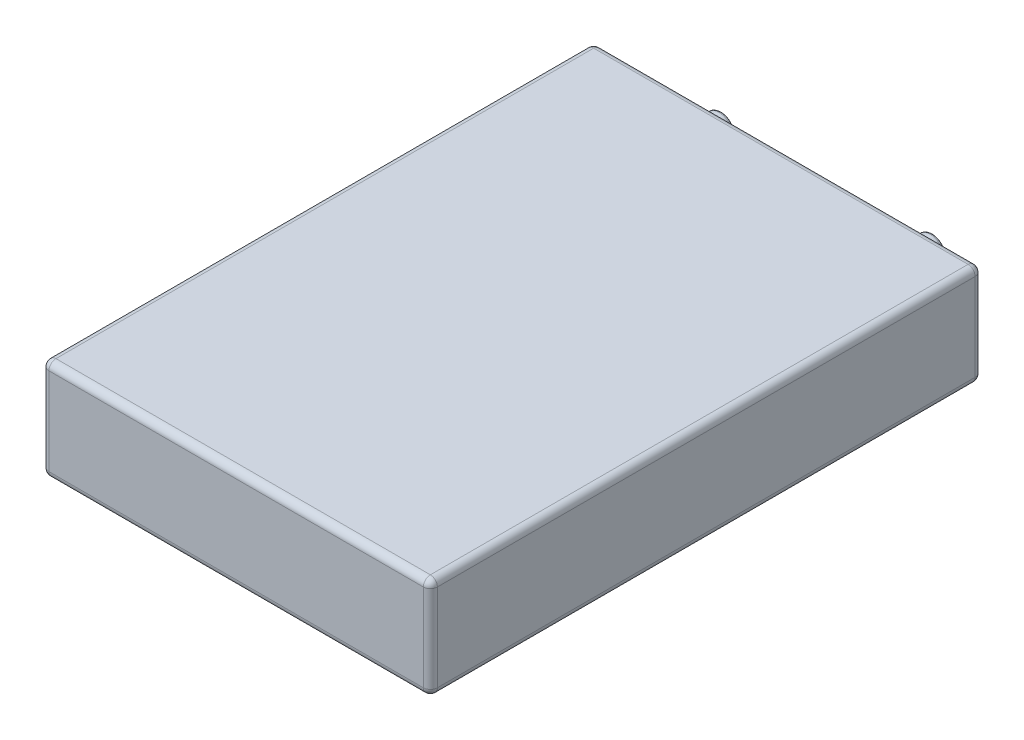
from build123d import *

# Parameters (mm, degrees)
BOSS_EXTRUDE1_DEPTH = 36
FILLET1_R           = 2.5
SKETCH2_R           = 10
BOSS_EXTRUDE2_DEPTH = 4
SKETCH3_R           = 5
BOSS_EXTRUDE3_DEPTH = 10
FILLET2_R           = 1


with BuildPart() as part:
    # Sketch1 → Boss-Extrude1 (new body)
    with BuildSketch(Plane(origin=(0, 0, 0), x_dir=(1, 0, 0), z_dir=(0, 1, 0))):
        with BuildLine():
            Line((66.5, -98), (-66.5, -98))
            ThreePointArc((-66.5, -98), (-68.267766953, -97.267766953), (-69, -95.5))
            Line((-69, -95.5), (-69, 95.5))
            ThreePointArc((-69, 95.5), (-68.267766953, 97.267766953), (-66.5, 98))
            Line((-66.5, 98), (66.5, 98))
            ThreePointArc((66.5, 98), (68.267766953, 97.267766953), (69, 95.5))
            Line((69, 95.5), (69, -95.5))
            ThreePointArc((69, -95.5), (68.267766953, -97.267766953), (66.5, -98))
        make_face()
    extrude(amount=BOSS_EXTRUDE1_DEPTH)

    # Fillet1
    fillet1_edges = [part.edges().sort_by_distance(p)[0] for p in [
        (69, 0, 0),
        (68.267766953, 0, 97.267766953),
        (0, 0, 98),
        (-68.267766953, 0, 97.267766953),
        (68.267766953, 36, 97.267766953),
        (69, 36, 0),
        (68.267766953, 36, -97.267766953),
        (0, 36, -98),
        (-68.267766953, 36, -97.267766953),
        (-69, 36, 0),
        (-68.267766953, 36, 97.267766953),
        (-69, 0, 0),
        (0, 36, 98),
        (-68.267766953, 0, -97.267766953),
        (0, 0, -98),
        (68.267766953, 0, -97.267766953),
    ]]
    fillet(fillet1_edges, radius=FILLET1_R)

    # Sketch2 → Boss-Extrude2 (add)
    with BuildSketch(Plane(origin=(0, 0, -98), x_dir=(-1, 0, 0), z_dir=(0, 0, -1))):
        with Locations(Location((-37.5, 18, 0), (0, 0, 180))):
            Circle(SKETCH2_R)
        with Locations(Location((37.5, 18, 0), (0, 0, 180))):
            Circle(SKETCH2_R)
    extrude(amount=BOSS_EXTRUDE2_DEPTH)

    # Sketch3 → Boss-Extrude3 (add)
    with BuildSketch(Plane(origin=(0, 0, -102), x_dir=(-1, 0, 0), z_dir=(0, 0, -1))):
        with Locations((-37.5, 18)):
            Circle(SKETCH3_R)
        with Locations((37.5, 18)):
            Circle(SKETCH3_R)
    extrude(amount=BOSS_EXTRUDE3_DEPTH)

    # Fillet2
    fillet2_edges = [part.edges().sort_by_distance(p)[0] for p in [
        (27.5, 18, -102),
        (-47.5, 18, -102),
        (42.5, 18, -112),
        (-32.5, 18, -112),
    ]]
    fillet(fillet2_edges, radius=FILLET2_R)


solid = part.part
